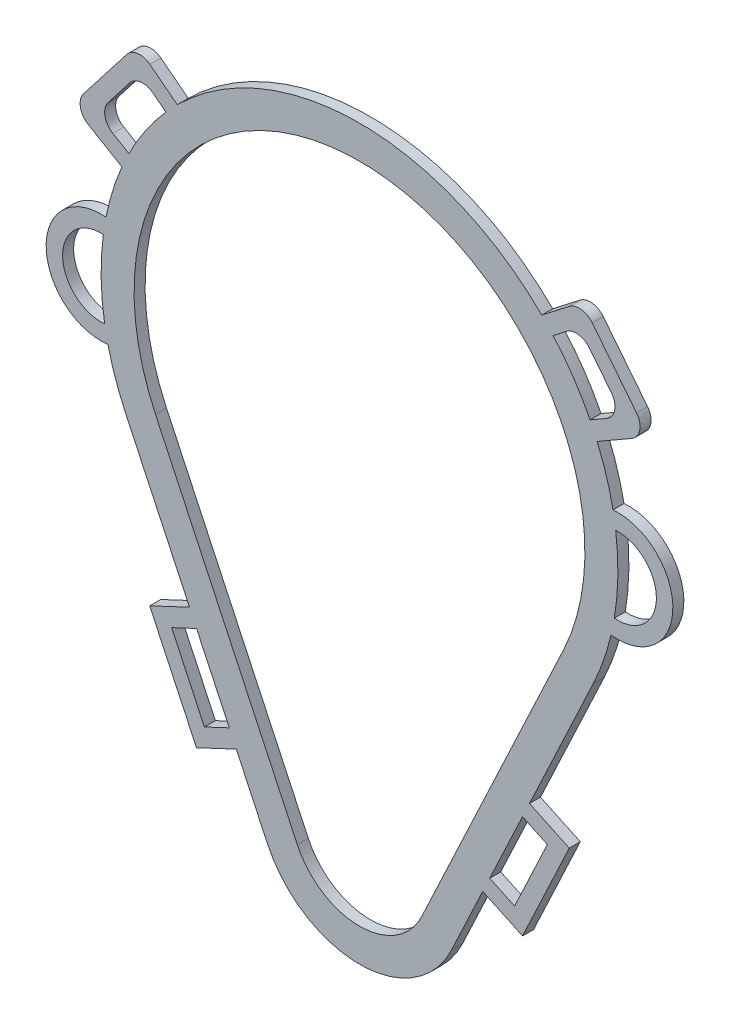
from build123d import *

# Parameters (mm, degrees)
BOSS_EXTRUDE1_DEPTH = 2
BOSS_EXTRUDE2_DEPTH = 2
BOSS_EXTRUDE3_DEPTH = 2
BOSS_EXTRUDE4_DEPTH = 2


with BuildPart() as part:
    # Sketch1 → Boss-Extrude1 (new body)
    with BuildSketch(Plane.XY):
        with BuildLine():
            Line((-42.535849019, -19.992537313), (-16.742834188, -74.869402985))
            ThreePointArc((-16.742834188, -74.869402985), (0, -85.5), (16.742834188, -74.869402985))
            Line((16.742834188, -74.869402985), (42.535849019, -19.992537313))
            ThreePointArc((42.535849019, -19.992537313), (0, 47), (-42.535849019, -19.992537313))
        make_face()
        with BuildLine():
            Line((37.105740634, -17.440298507), (11.312725803, -72.317164179))
            ThreePointArc((11.312725803, -72.317164179), (0, -79.5), (-11.312725803, -72.317164179))
            Line((-11.312725803, -72.317164179), (-37.105740634, -17.440298507))
            ThreePointArc((-37.105740634, -17.440298507), (0, 41), (37.105740634, -17.440298507))
        make_face(mode=Mode.SUBTRACT)
    extrude(amount=BOSS_EXTRUDE1_DEPTH)

    # Sketch2 → Boss-Extrude2 (add)
    # profile 1 of 2: a face of its own
    with BuildSketch(Plane.XY.offset(2)):
        Polygon((38.155605521, -48.118901031), (29.648142834, -66.219262316), (19.692944127, -61.540157838), (28.200406814, -43.439796554), align=None)
        Polygon((29.639341604, -47.430970149), (34.164431925, -49.557835821), (28.209208044, -62.22808872), (23.684117723, -60.101223049), align=None, mode=Mode.SUBTRACT)
    # profile 2 of 2: a face of its own
    with BuildSketch(Plane.XY.offset(2)):
        Polygon((-28.200406814, -43.439796554), (-38.155605521, -48.118901031), (-29.648142834, -66.219262316), (-19.692944127, -61.540157838), align=None)
        Polygon((-29.639341604, -47.430970149), (-23.684117723, -60.101223049), (-28.209208044, -62.22808872), (-34.164431925, -49.557835821), align=None, mode=Mode.SUBTRACT)
    extrude(amount=-BOSS_EXTRUDE2_DEPTH)

    # Sketch3 → Boss-Extrude3 (add)
    # profile 1 of 2: a face of its own
    with BuildSketch(Plane.XY.offset(2)):
        with BuildLine():
            Line((-31.151373165, 31.772817784), (-38.114457897, 37.177116489))
            ThreePointArc((-38.114457897, 37.177116489), (-40.329006137, 37.783626199), (-42.323795344, 36.64657125))
            Line((-42.323795344, 36.64657125), (-50.184128352, 26.519047267))
            ThreePointArc((-50.184128352, 26.519047267), (-50.760622602, 24.115277799), (-49.336666072, 22.094683561))
            Line((-49.336666072, 22.094683561), (-41.03528616, 17.205385487))
            Line((-41.03528616, 17.205385487), (-31.151373165, 31.772817784))
        make_face()
        with BuildLine():
            Line((-35.213971315, 31.128382936), (-37.583912658, 32.967779041))
            ThreePointArc((-37.583912658, 32.967779041), (-39.798460899, 33.574288752), (-41.793250106, 32.437233803))
            Line((-41.793250106, 32.437233803), (-45.72341661, 27.373471811))
            ThreePointArc((-45.72341661, 27.373471811), (-46.29991086, 24.969702343), (-44.87595433, 22.949108105))
            Line((-44.87595433, 22.949108105), (-41.937721652, 21.218565047))
            Line((-41.937721652, 21.218565047), (-35.213971315, 31.128382936))
        make_face(mode=Mode.SUBTRACT)
    # profile 2 of 2: a face of its own
    with BuildSketch(Plane.XY.offset(2)):
        with BuildLine():
            Line((31.151373165, 31.772817784), (41.03528616, 17.205385487))
            Line((41.03528616, 17.205385487), (49.521231884, 22.082259987))
            ThreePointArc((49.521231884, 22.082259987), (50.972840228, 24.118942465), (50.376596508, 26.547879626))
            Line((50.376596508, 26.547879626), (42.329184832, 36.691250185))
            ThreePointArc((42.329184832, 36.691250185), (40.338269585, 37.80509541), (38.139596853, 37.19662773))
            Line((38.139596853, 37.19662773), (31.151373165, 31.772817784))
        make_face()
        with BuildLine():
            Line((35.213971315, 31.128382936), (41.937721652, 21.218565047))
            Line((41.937721652, 21.218565047), (44.9588763, 22.954823155))
            ThreePointArc((44.9588763, 22.954823155), (46.410484644, 24.991505634), (45.814240924, 27.420442794))
            Line((45.814240924, 27.420442794), (41.798639593, 32.481912737))
            ThreePointArc((41.798639593, 32.481912737), (39.807724347, 33.595757962), (37.609051614, 32.987290283))
            Line((37.609051614, 32.987290283), (35.213971315, 31.128382936))
        make_face(mode=Mode.SUBTRACT)
    extrude(amount=-BOSS_EXTRUDE3_DEPTH)

    # Sketch4 → Boss-Extrude4 (add)
    # profile 1 of 2: a face of its own
    with BuildSketch(Plane.XY.offset(2)):
        with BuildLine():
            Line((42.848392472, 8.262286082), (42.848392472, -9.939496711))
            ThreePointArc((42.848392472, -9.939496711), (56.992517927, -0.838605315), (42.848392472, 8.262286082))
        make_face()
        with BuildLine():
            Line((45.848392472, 6.067260087), (45.848392472, -7.744470716))
            ThreePointArc((45.848392472, -7.744470716), (53.992517927, -0.838605315), (45.848392472, 6.067260087))
        make_face(mode=Mode.SUBTRACT)
    # profile 2 of 2: a face of its own
    with BuildSketch(Plane.XY.offset(2)):
        with BuildLine():
            Line((-42.848392472, 8.262286082), (-42.848392472, -9.939496711))
            ThreePointArc((-42.848392472, -9.939496711), (-56.992517927, -0.838605315), (-42.848392472, 8.262286082))
        make_face()
        with BuildLine():
            Line((-45.848392472, 6.067260087), (-45.848392472, -7.744470716))
            ThreePointArc((-45.848392472, -7.744470716), (-53.992517927, -0.838605315), (-45.848392472, 6.067260087))
        make_face(mode=Mode.SUBTRACT)
    extrude(amount=-BOSS_EXTRUDE4_DEPTH)


solid = part.part
